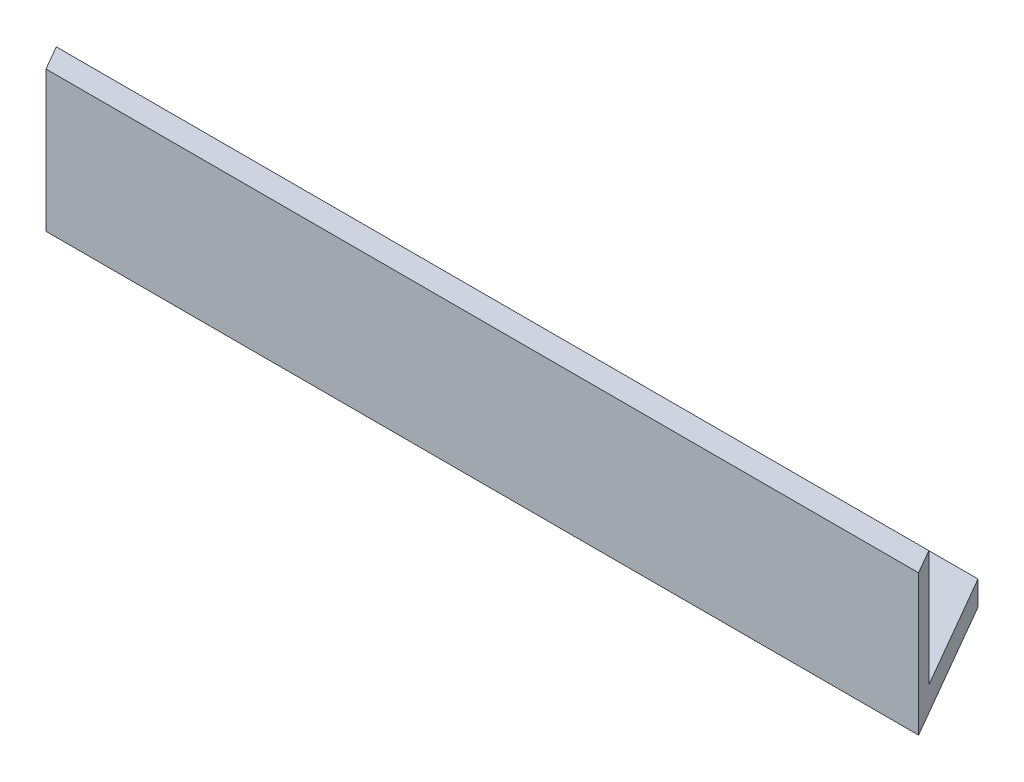
from build123d import *

# Parameters (mm, degrees)
BOSS_EXTRUDE1_DEPTH = 240
CUT_EXTRUDE1_DEPTH  = 242.660919472


with BuildPart() as part:
    # Sketch1 → Boss-Extrude1 (new body)
    with BuildSketch(Plane(origin=(0, 0, 0), x_dir=(0, 0, -1), z_dir=(1, 0, 0))):
        Polygon((0, 0), (20, 0), (20, 3.461178467), (3.461178467, 3.461178467), (3.461178467, 20), (0, 20), align=None)
    extrude(amount=BOSS_EXTRUDE1_DEPTH)

    # Sketch2 → Cut-Extrude1 (cut, through all)
    with BuildSketch(Plane.XZ):
        Polygon((0, -20), (0, 0), (11.547005384, 0), align=None)
        Polygon((240, 0), (240, -20), (124.130307876, -20), (135.67731326, 0), align=None)
    extrude(amount=-CUT_EXTRUDE1_DEPTH, mode=Mode.SUBTRACT)


solid = part.part
